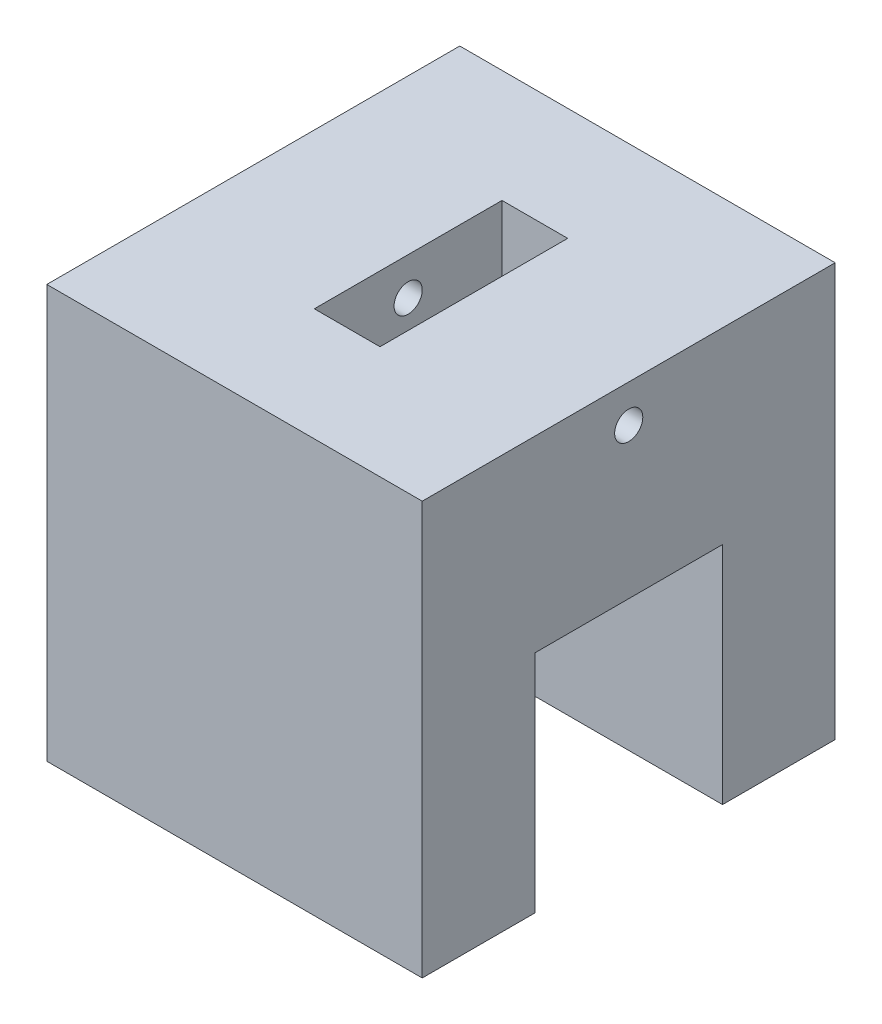
from build123d import *

# Parameters (mm, degrees)
BOSS_EXTRUDE2_DEPTH      = 100
BOSS_EXTRUDE2_DEPTH_BACK = 100
SKETCH3_R                = 7.5
SKETCH4_W                = 35
SKETCH4_H                = 100
CUT_EXTRUDE1_DEPTH       = 60
SKETCH5_R                = 7.5
CUT_EXTRUDE2_DEPTH       = 60


with BuildPart() as part:
    # Sketch3 → Boss-Extrude2 (new, two sides: drawn at the far end of the back side and taken through both)
    with BuildSketch(Plane(origin=(0, 0, 0), x_dir=(0, 0, -1), z_dir=(1, 0, 0)).offset(-BOSS_EXTRUDE2_DEPTH_BACK)):
        Polygon((-110, -120), (-50, -120), (-50, 0), (50, 0), (50, -120), (110, -120), (110, 100), (-110, 100), align=None)
        with Locations((0, 80)):
            Circle(SKETCH3_R, mode=Mode.SUBTRACT)
    extrude(amount=BOSS_EXTRUDE2_DEPTH + BOSS_EXTRUDE2_DEPTH_BACK)

    # Sketch4 → Cut-Extrude1 (cut)
    with BuildSketch(Plane(origin=(0, 100, 0), x_dir=(1, 0, 0), z_dir=(0, 1, 0))):
        Rectangle(SKETCH4_W, SKETCH4_H)
    extrude(amount=-CUT_EXTRUDE1_DEPTH, mode=Mode.SUBTRACT)

    # Sketch5 → Cut-Extrude2 (cut)
    with BuildSketch(Plane.XZ):
        with Locations((-70, 0)):
            Circle(SKETCH5_R)
        with Locations((70, 0)):
            Circle(SKETCH5_R)
    extrude(amount=-CUT_EXTRUDE2_DEPTH, mode=Mode.SUBTRACT)


solid = part.part
